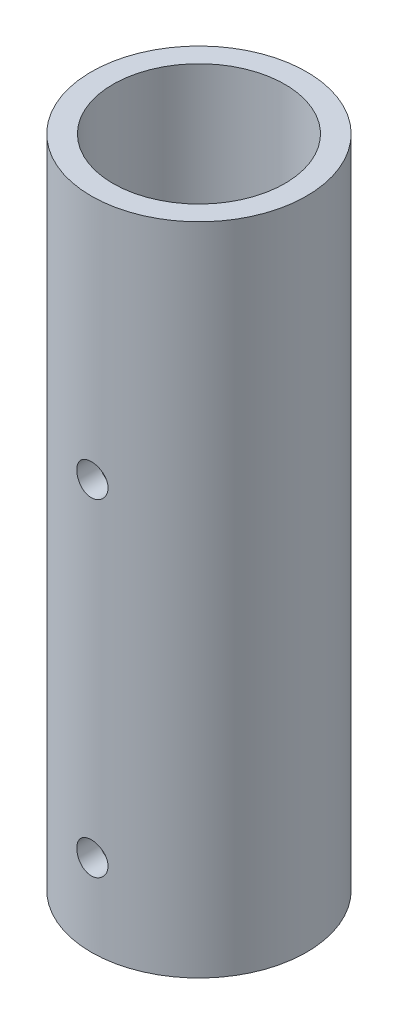
from build123d import *

# Parameters (mm, degrees)
SKETCH1_R               = 16.7005
SKETCH1_R_2             = 13.335
BOSS_EXTRUDE1_DEPTH     = 101.6
CUT_EXTRUDE1_DEPTH      = 105.309028375
CUT_EXTRUDE1_DEPTH_BACK = 105.309028375
SKETCH2_R               = 2.4257


with BuildPart() as part:
    # Sketch1 → Boss-Extrude1 (new body)
    with BuildSketch(Plane(origin=(0, 0, 0), x_dir=(1, 0, 0), z_dir=(0, 1, 0))):
        with Locations(Location((0, 0, 0), (0, 0, 270))):
            Circle(SKETCH1_R)
        with Locations(Location((0, 0, 0), (0, 0, 270))):
            Circle(SKETCH1_R_2, mode=Mode.SUBTRACT)
    extrude(amount=BOSS_EXTRUDE1_DEPTH)

    # Sketch2 → Cut-Extrude1 (cut, two sides: drawn at the far end of the back side and taken through both)
    with BuildSketch(Plane.XY.offset(-CUT_EXTRUDE1_DEPTH_BACK)):
        with Locations((0, 63.5)):
            Circle(SKETCH2_R)
        with Locations((0, 12.7)):
            Circle(SKETCH2_R)
    extrude(amount=CUT_EXTRUDE1_DEPTH + CUT_EXTRUDE1_DEPTH_BACK, mode=Mode.SUBTRACT)


solid = part.part
